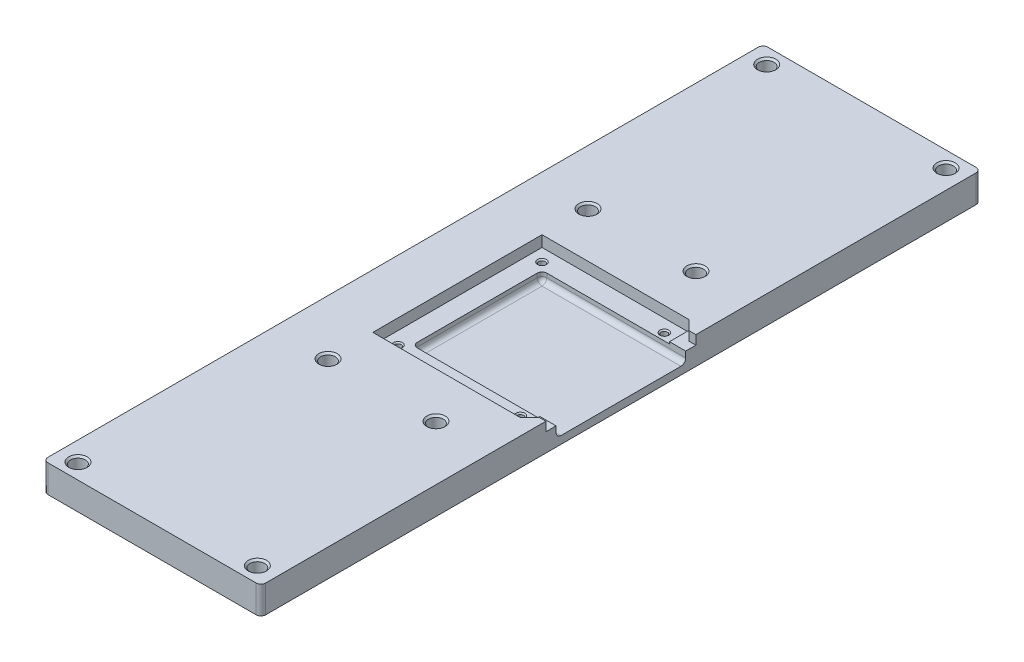
from build123d import *

# Parameters (mm, degrees)
BOSS_EXTRUDE1_DEPTH     = 11.5
SKETCH4_R               = 3.075
CUT_EXTRUDE1_DEPTH      = 6
CUT_EXTRUDE6_DEPTH      = 4.6
CUT_EXTRUDE3_DEPTH      = 157.86459328
CUT_EXTRUDE3_DEPTH_BACK = 3.7
SKETCH24_W              = 59.875
SKETCH24_H              = 54
SKETCH25_R              = 1.35
CUT_EXTRUDE4_DEPTH      = 5
CHAMFER4_SIZE           = 0.5
FILLET1_R               = 2
BOSS_EXTRUDE2_DEPTH     = 0.8
CHAMFER5_SIZE           = 0.75


with BuildPart() as part:
    # Sketch1 → Boss-Extrude1 (new body)
    with BuildSketch(Plane(origin=(0, 0, 0), x_dir=(1, 0, 0), z_dir=(0, 1, 0))):
        with BuildLine():
            Line((-45.375, 135), (-45.375, -135))
            Line((-45.375, -135), (-45.375, -148))
            ThreePointArc((-45.375, -148), (-44.789213562, -149.414213562), (-43.375, -150))
            Line((-43.375, -150), (43.375, -150))
            ThreePointArc((43.375, -150), (44.789213562, -149.414213562), (45.375, -148))
            Line((45.375, -148), (45.375, -135))
            Line((45.375, -135), (45.375, 135))
            Line((45.375, 135), (45.375, 148))
            ThreePointArc((45.375, 148), (44.789213562, 149.414213562), (43.375, 150))
            Line((43.375, 150), (-43.375, 150))
            ThreePointArc((-43.375, 150), (-44.789213562, 149.414213562), (-45.375, 148))
            Line((-45.375, 148), (-45.375, 135))
        make_face()
    extrude(amount=BOSS_EXTRUDE1_DEPTH)

    # Sketch4 → Cut-Extrude1 (cut)
    with BuildSketch(Plane(origin=(0, 11.5, 0), x_dir=(1, 0, 0), z_dir=(0, 1, 0))):
        with Locations(Location((-37.375, -143.5, 0), (0, 0, 270))):
            Circle(SKETCH4_R)
        with Locations(Location((37.375, -143.5, 0), (0, 0, 270))):
            Circle(SKETCH4_R)
        with Locations(Location((37.375, 143.5, 0), (0, 0, 270))):
            Circle(SKETCH4_R)
        with Locations(Location((-37.375, 143.5, 0), (0, 0, 270))):
            Circle(SKETCH4_R)
        with Locations(Location((-22.5, -54.175, 0), (0, 0, 270))):
            Circle(SKETCH4_R)
        with Locations(Location((22.5, -54.175, 0), (0, 0, 270))):
            Circle(SKETCH4_R)
        with Locations(Location((22.5, 54.175, 0), (0, 0, 270))):
            Circle(SKETCH4_R)
        with Locations(Location((-22.5, 54.175, 0), (0, 0, 270))):
            Circle(SKETCH4_R)
    extrude(amount=-CUT_EXTRUDE1_DEPTH, mode=Mode.SUBTRACT)

    # Sketch21 → Cut-Extrude6 (cut)
    with BuildSketch(Plane(origin=(0, 11.5, 0), x_dir=(1, 0, 0), z_dir=(0, 1, 0))):
        Polygon((45.375, 31), (45.375, -31), (45.375, -31.25), (42.603553391, -31.25), (38.603553391, -35.25), (-22.75, -35.25), (-22.75, 35.25), (38.603553391, 35.25), (42.603553391, 31.25), (45.375, 31.25), align=None)
    extrude(amount=-CUT_EXTRUDE6_DEPTH, mode=Mode.SUBTRACT)

    # Sketch24 → Cut-Extrude3 (cut, two sides: drawn at the far end of the back side and taken through both)
    with BuildSketch(Plane(origin=(0, 6.9, 0), x_dir=(1, 0, 0), z_dir=(0, 1, 0)).offset(-CUT_EXTRUDE3_DEPTH_BACK)):
        with Locations((15.4375, 0)):
            Rectangle(SKETCH24_W, SKETCH24_H)
    extrude(amount=CUT_EXTRUDE3_DEPTH + CUT_EXTRUDE3_DEPTH_BACK, mode=Mode.SUBTRACT)

    # Sketch25 → Cut-Extrude4 (cut)
    with BuildSketch(Plane(origin=(0, 6.9, 0), x_dir=(1, 0, 0), z_dir=(0, 1, 0))):
        with Locations(Location((33.5, 30, 0), (0, 0, 270))):
            Circle(SKETCH25_R)
        with Locations(Location((-17.5, 30, 0), (0, 0, 270))):
            Circle(SKETCH25_R)
        with Locations(Location((33.5, -30, 0), (0, 0, 270))):
            Circle(SKETCH25_R)
        with Locations(Location((-17.5, -30, 0), (0, 0, 270))):
            Circle(SKETCH25_R)
    extrude(amount=-CUT_EXTRUDE4_DEPTH, mode=Mode.SUBTRACT)

    # Chamfer4
    chamfer4_edges = [part.edges().sort_by_distance(p)[0] for p in [
        (-17.5, 6.9, -31.35),
        (33.5, 6.9, 28.65),
        (-17.5, 6.9, 28.65),
        (33.5, 6.9, -31.35),
    ]]
    chamfer(chamfer4_edges, length=CHAMFER4_SIZE)

    # Fillet1
    fillet1_edges = [part.edges().sort_by_distance(p)[0] for p in [
        (15.4375, 3.2, -27),
        (-14.5, 5.05, -27),
        (-14.5, 3.2, 0),
        (-14.5, 5.05, 27),
        (15.4375, 3.2, 27),
    ]]
    fillet(fillet1_edges, radius=FILLET1_R)

    # Sketch26 → Boss-Extrude2 (add)
    with BuildSketch(Plane(origin=(0, 6.9, 0), x_dir=(1, 0, 0), z_dir=(0, 1, 0))):
        Polygon((38.603553391, 35.25), (38.603553391, 27), (45.375, 27), (45.375, 31.25), (42.603553391, 31.25), align=None)
        Polygon((42.603553391, -31.25), (38.603553391, -35.25), (38.603553391, -27), (45.375, -27), (45.375, -31.25), align=None)
    extrude(amount=BOSS_EXTRUDE2_DEPTH)

    # Chamfer5
    chamfer5_edges = [part.edges().sort_by_distance(p)[0] for p in [
        (37.375, 11.5, 140.425),
        (37.375, 11.5, -146.575),
        (-22.5, 11.5, 51.1),
        (22.5, 11.5, 51.1),
        (-22.5, 11.5, -57.25),
        (22.5, 11.5, -57.25),
        (-37.375, 11.5, -146.575),
        (-37.375, 11.5, 140.425),
    ]]
    chamfer(chamfer5_edges, length=CHAMFER5_SIZE)


solid = part.part
